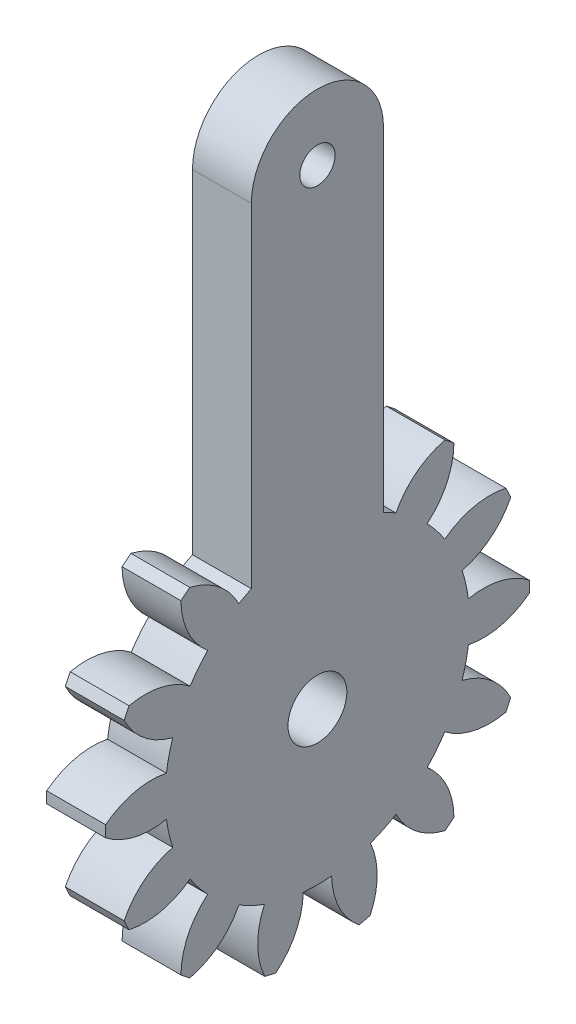
from build123d import *

# Parameters (mm, degrees)
BASPROSKE_W        = 5
BASPROSKE_H        = 18
TOOTHCUT_DEPTH     = 26.942243542
TEETHCUTS_COUNT    = 14
TEETHCUTS_ANGLE    = 334.285714286
BORSKE_R           = 2.5
BORE_DEPTH         = 50.0000508
BOSS_EXTRU_1_START = -5
ESQUISSE1_R        = 1.5
BOSS_EXTRU_1_DEPTH = 5


with BuildPart() as part:
    # BasProSke → Base-Revolve (revolve)
    with BuildSketch(Plane(origin=(0, 0, 0), x_dir=(1, 0, 0), z_dir=(0, 1, 0)), mode=Mode.PRIVATE) as base_revolve_sk:
        with Locations((2.5, 9)):
            Rectangle(BASPROSKE_W, BASPROSKE_H)
    revolve(base_revolve_sk.sketch.rotate(Axis((-10, 0, 0), (1, 0, 0)), 180), axis=Axis((-10, 0, 0), (1, 0, 0)))

    # TooCutSke → ToothCut (cut, through all)
    with BuildSketch(Plane(origin=(0, 0, 0), x_dir=(0, 0, -1), z_dir=(1, 0, 0))):
        with BuildLine():
            ThreePointArc((1.203681085, 12.880379812), (0, 12.9365), (-1.203681085, 12.880379812))
            ThreePointArc((-1.203681085, 12.880379812), (-1.848830306, 15.53724288), (-3.558778134, 17.670601103))
            ThreePointArc((-3.558778134, 17.670601103), (0, 18.0254), (3.558778134, 17.670601103))
            ThreePointArc((3.558778134, 17.670601103), (1.848830306, 15.53724288), (1.203681085, 12.880379812))
        make_face()
    toothcut = extrude(amount=TOOTHCUT_DEPTH, mode=Mode.SUBTRACT)

    # TeethCuts: ToothCut ×14 about axis
    teethcuts_axis = Axis((-10, 0, 0), (1, 0, 0))
    for i in range(1, TEETHCUTS_COUNT):
        add(toothcut.rotate(teethcuts_axis, i * TEETHCUTS_ANGLE / (TEETHCUTS_COUNT - 1)), mode=Mode.SUBTRACT)

    # BorSke → Bore (cut, symmetric)
    with BuildSketch(Plane(origin=(0, 0, 0), x_dir=(0, 0, -1), z_dir=(1, 0, 0))):
        with Locations(Location((0, 0, 0), (0, 0, 180))):
            Circle(BORSKE_R)
    extrude(amount=BORE_DEPTH, both=True, mode=Mode.SUBTRACT)

    # Esquisse1 → Boss.-Extru.1 (add)
    with BuildSketch(Plane(origin=(5, 0, 0), x_dir=(0, 0, -1), z_dir=(1, 0, 0)).offset(BOSS_EXTRU_1_START)):
        with BuildLine():
            Line((-5.612936991, 11.65538376), (-5.612936991, 40))
            ThreePointArc((-5.612936991, 40), (0, 45.612936991), (5.612936991, 40))
            Line((5.612936991, 40), (5.612936991, 11.65538376))
            ThreePointArc((5.612936991, 11.65538376), (0, 12.9365), (-5.612936991, 11.65538376))
        make_face()
        with Locations((0, 40)):
            Circle(ESQUISSE1_R, mode=Mode.SUBTRACT)
    extrude(amount=BOSS_EXTRU_1_DEPTH)


solid = part.part
